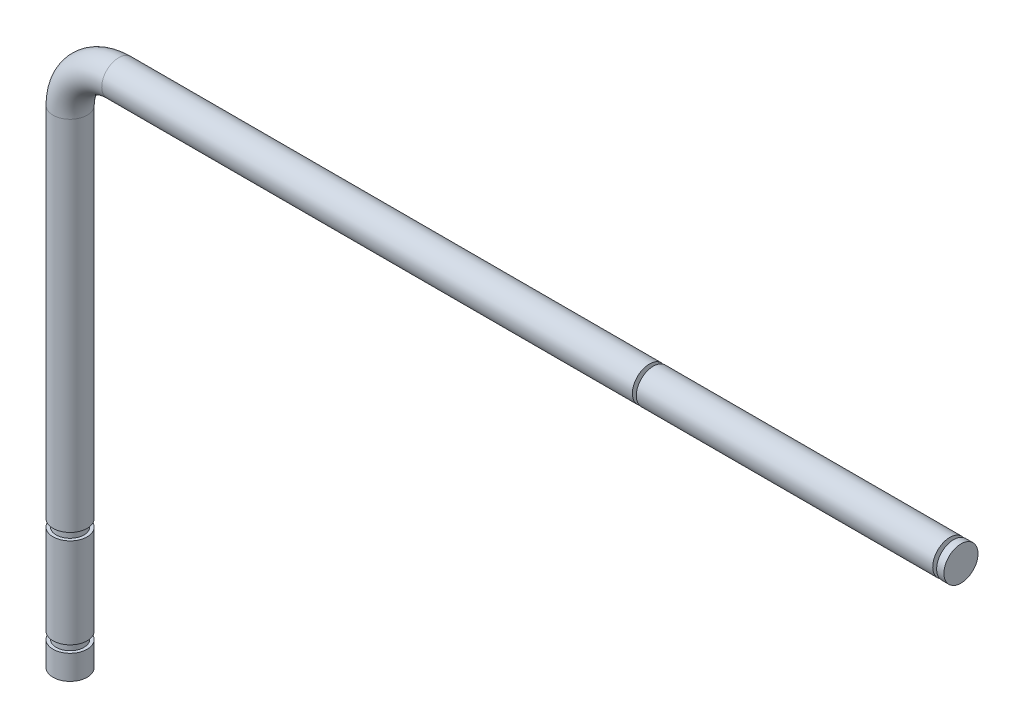
from build123d import *

# Parameters (mm, degrees)
WYCI_GNI_CIE_PO_CIE_CE1_PROFILE_R = 3.5
SZKIC26_R                         = 4
SZKIC26_R_2                       = 2.85
WYTNIJ_WYCI_GNI_CIE1_DEPTH        = 1.5
SZKIC36_R                         = 4
SZKIC36_R_2                       = 2.85
WYTNIJ_WYCI_GNI_CIE3_DEPTH        = 1.5
SZKIC46_R                         = 4
SZKIC46_R_2                       = 1.6
WYTNIJ_WYCI_GNI_CIE4_DEPTH        = 0.8
WYTNIJ_WYCI_GNI_CIE5_START        = 0.8
SZKIC53_R                         = 4
SZKIC53_R_2                       = 1.6
WYTNIJ_WYCI_GNI_CIE5_DEPTH        = 0.8
SZKIC54_R                         = 1.25
WYTNIJ_WYCI_GNI_CIE6_DEPTH        = 10


with BuildPart() as part:
    # Wyciągnięcie po ścieżce1: sweep along a path in Szkic1
    with BuildLine(Plane.XY) as wyci_gni_cie_po_cie_ce1_path:
        Line((183, 0), (10, 0))
        ThreePointArc((10, 0), (2.928932188, -2.928932188), (0, -10))
        Line((0, -10), (0, -110))
    # Wyciągnięcie po ścieżce1 profile (on start of the path) → Wyciągnięcie po ścieżce1 (sweep)
    with BuildSketch(Plane(origin=(183, 0, 0), x_dir=(0, 0, -1), z_dir=(-1, 0, 0))):
        Circle(WYCI_GNI_CIE_PO_CIE_CE1_PROFILE_R)
    sweep(path=wyci_gni_cie_po_cie_ce1_path.line)

    # Szkic26 → Wytnij-wyciągnięcie1 (cut)
    with BuildSketch(Plane(origin=(0, -105, 0), x_dir=(-1, 0, 0), z_dir=(0, -1, 0))):
        Circle(SZKIC26_R)
        with Locations(Location((0, 0, 0), (0, 0, 180))):
            Circle(SZKIC26_R_2, mode=Mode.SUBTRACT)
    extrude(amount=-WYTNIJ_WYCI_GNI_CIE1_DEPTH, mode=Mode.SUBTRACT)

    # Szkic36 → Wytnij-wyciągnięcie3 (cut)
    with BuildSketch(Plane(origin=(0, -85, 0), x_dir=(-1, 0, 0), z_dir=(0, -1, 0))):
        Circle(SZKIC36_R)
        with Locations(Location((0, 0, 0), (0, 0, 180))):
            Circle(SZKIC36_R_2, mode=Mode.SUBTRACT)
    extrude(amount=-WYTNIJ_WYCI_GNI_CIE3_DEPTH, mode=Mode.SUBTRACT)

    # Szkic46 → Wytnij-wyciągnięcie4 (cut)
    with BuildSketch(Plane(origin=(181.5, 0, 0), x_dir=(0, 0, -1), z_dir=(1, 0, 0))):
        Circle(SZKIC46_R)
        with Locations(Location((0, 0, 0), (0, 0, 90))):
            Circle(SZKIC46_R_2, mode=Mode.SUBTRACT)
    extrude(amount=-WYTNIJ_WYCI_GNI_CIE4_DEPTH, mode=Mode.SUBTRACT)

    # Szkic53 → Wytnij-wyciągnięcie5 (cut)
    with BuildSketch(Plane(origin=(119, 0, 0), x_dir=(0, 0, -1), z_dir=(1, 0, 0)).offset(WYTNIJ_WYCI_GNI_CIE5_START)):
        Circle(SZKIC53_R)
        with Locations(Location((0, 0, 0), (0, 0, 90))):
            Circle(SZKIC53_R_2, mode=Mode.SUBTRACT)
    extrude(amount=-WYTNIJ_WYCI_GNI_CIE5_DEPTH, mode=Mode.SUBTRACT)

    # Szkic54 → Wytnij-wyciągnięcie6 (cut)
    with BuildSketch(Plane(origin=(0, -110, 0), x_dir=(-1, 0, 0), z_dir=(0, -1, 0))):
        with Locations(Location((0, 0, 0), (0, 0, 180))):
            Circle(SZKIC54_R)
    extrude(amount=-WYTNIJ_WYCI_GNI_CIE6_DEPTH, mode=Mode.SUBTRACT)


solid = part.part
